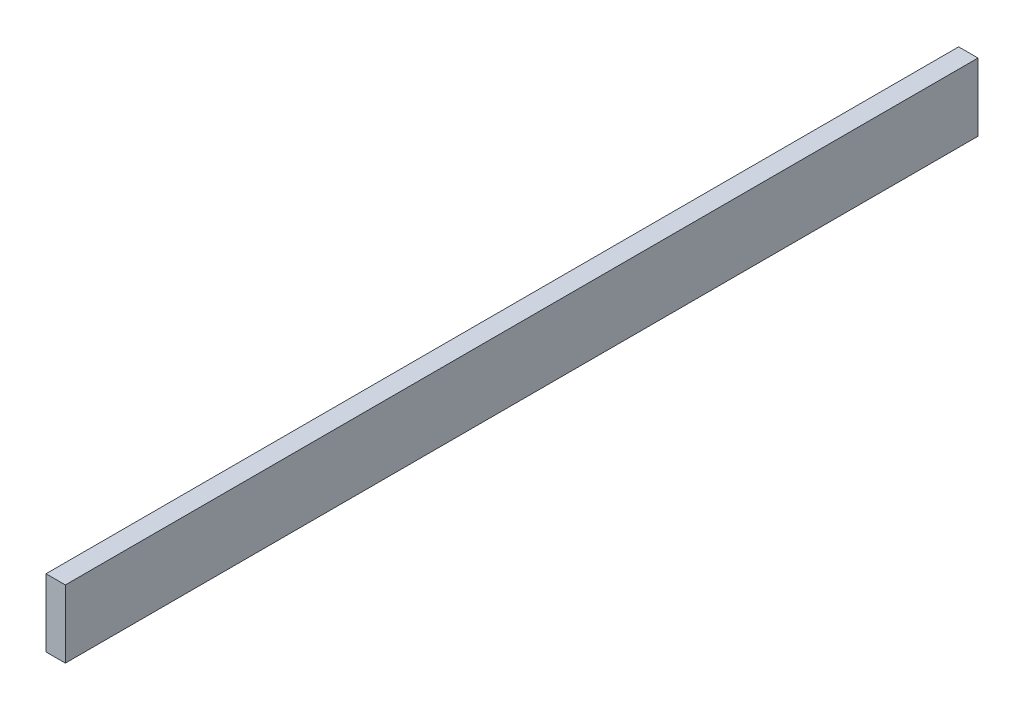
from build123d import *

# Parameters (mm, degrees)
SKETCH1_W                        = 14
SKETCH1_H                        = 49
RAY_DIS_PROFIL_14X49X660_1_DEPTH = 660


with BuildPart() as part:
    # Sketch1 → RAY_DIS_PROFIL_14x49x660_1 (new body)
    with BuildSketch(Plane.XY):
        with Locations((7, 24.5)):
            Rectangle(SKETCH1_W, SKETCH1_H)
    extrude(amount=-RAY_DIS_PROFIL_14X49X660_1_DEPTH)


solid = part.part
